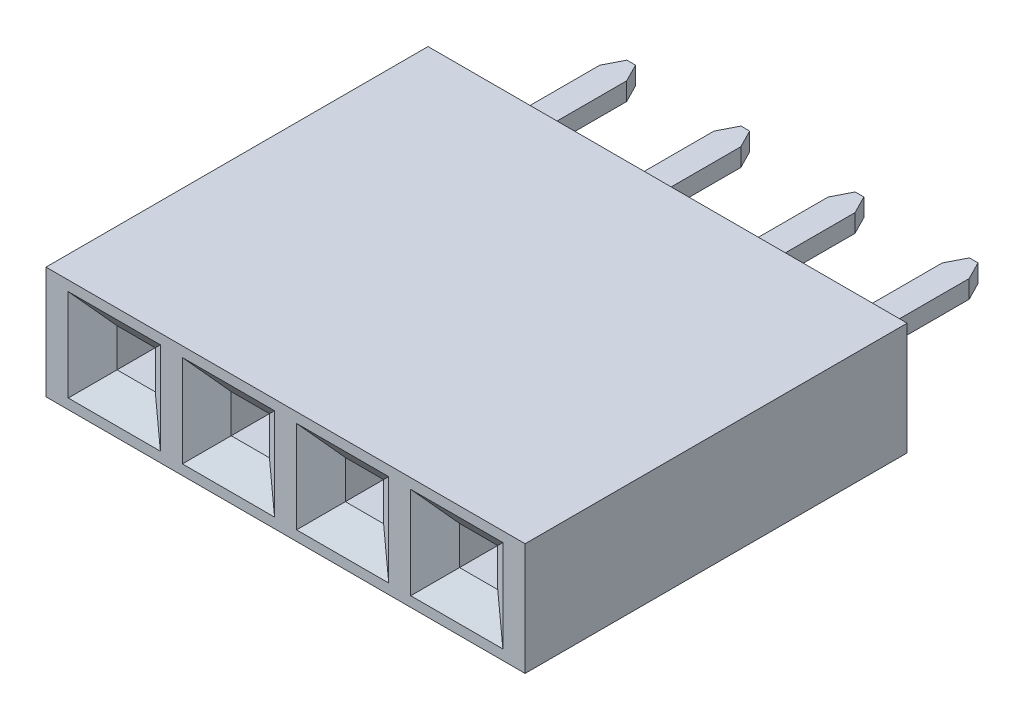
from build123d import *
from OCP.BRepFilletAPI import BRepFilletAPI_MakeChamfer

# Parameters (mm, degrees)
SKETCH_1_W                          = 10.66
SKETCH_1_H                          = 2.5
EXTRUDE_1_DEPTH                     = 8.5
SKETCH_2_W                          = 0.85
SKETCH_2_H                          = 0.85
CUT_EXTRUDE_1_DEPTH                 = 6
CHAMFER_1_SIZE                      = 0.6
CHAMFER_1_SIZE2                     = 0.48587042
PATTERN_LINEAR_1_COUNT              = 4
PATTERN_LINEAR_1_PITCH              = 2.54
CHAMFER_1_OF_PATTERN_LINEAR_1_SIZE2 = 0.48587042
CHAMFER_1_OF_PATTERN_LINEAR_1_SIZE  = 0.6
SKETCH_3_W                          = 0.6
SKETCH_3_H                          = 0.4
EXTRUDE_2_DEPTH                     = 3
CHAMFER_2_SIZE                      = 0.4
CHAMFER_2_SIZE2                     = 0.20381018
PATTERN_LINEAR_2_COUNT              = 4
PATTERN_LINEAR_2_PITCH              = 2.54


with BuildPart() as part:
    # Эскиз1 → Бобышка-Вытянуть1 (new body)
    with BuildSketch(Plane.XY):
        Rectangle(SKETCH_1_W, SKETCH_1_H)
    extrude(amount=EXTRUDE_1_DEPTH)

    # Эскиз2 → Вырез-Вытянуть1 (cut)
    with BuildSketch(Plane.XY.offset(8.5)):
        with Locations((3.81, 0)):
            Rectangle(SKETCH_2_W, SKETCH_2_H)
    cut_extrude_1 = extrude(amount=-CUT_EXTRUDE_1_DEPTH, mode=Mode.SUBTRACT)

    # Фаска1
    chamfer_1_edges = [part.edges().sort_by_distance(p)[0] for p in [
        (4.235, 0, 8.5),
        (3.81, 0.425, 8.5),
        (3.385, 0, 8.5),
        (3.81, -0.425, 8.5),
    ]]
    chamfer_1_side = [part.faces().sort_by_distance(p)[0] for p in [
        (-0.10617009, 0, 8.5),
    ]]
    chamfer(chamfer_1_edges, length=CHAMFER_1_SIZE, length2=CHAMFER_1_SIZE2, reference=chamfer_1_side[0])

    # Линейный массив1: Вырез-Вытянуть1 ×4
    with Locations(*[(-i * PATTERN_LINEAR_1_PITCH, 0, 0) for i in range(1, PATTERN_LINEAR_1_COUNT)]):
        add(cut_extrude_1, mode=Mode.SUBTRACT)

    # Фаска1 of Линейный массив1
    chamfer_1_of_pattern_linear_1_edges = [part.edges().sort_by_distance(p)[0] for p in [
        (1.695, 0, 8.5),
        (1.27, 0.425, 8.5),
        (0.845, 0, 8.5),
        (1.27, -0.425, 8.5),
        (-0.845, 0, 8.5),
        (-1.27, 0.425, 8.5),
        (-1.695, 0, 8.5),
        (-1.27, -0.425, 8.5),
        (-3.385, 0, 8.5),
        (-3.81, 0.425, 8.5),
        (-4.235, 0, 8.5),
        (-3.81, -0.425, 8.5),
    ]]
    chamfer(chamfer_1_of_pattern_linear_1_edges, length=CHAMFER_1_OF_PATTERN_LINEAR_1_SIZE, length2=CHAMFER_1_OF_PATTERN_LINEAR_1_SIZE2)


with BuildPart() as body_2:
    # Эскиз3 → Бобышка-Вытянуть2 (new body)
    with BuildSketch(Plane(origin=(0, 0, 0), x_dir=(-1, 0, 0), z_dir=(0, 0, -1))):
        with Locations((-3.81, 0)):
            Rectangle(SKETCH_3_W, SKETCH_3_H)
    extrude(amount=EXTRUDE_2_DEPTH)

    # Фаска2: one chamfer whose edges measure the first distance from different faces: ONE call of the kernel's chamfer builder (chamfer() names one face for all edges)
    chamfer_2_edges_1 = [body_2.edges().sort_by_distance(p)[0] for p in [
        (3.51, 0, -3),
    ]]
    chamfer_2_side_1 = [body_2.faces().sort_by_distance(p)[0] for p in [
        (3.51, 0, -1.5),
    ]]
    chamfer_2_edges_2 = [body_2.edges().sort_by_distance(p)[0] for p in [
        (4.11, 0, -3),
    ]]
    chamfer_2_side_2 = [body_2.faces().sort_by_distance(p)[0] for p in [
        (4.11, 0, -1.5),
    ]]
    chamfer_2 = BRepFilletAPI_MakeChamfer(body_2.part.solid().wrapped)
    for e in chamfer_2_edges_1:
        chamfer_2.Add(CHAMFER_2_SIZE, CHAMFER_2_SIZE2, e.wrapped, chamfer_2_side_1[0].wrapped)  # the first distance lies on this face
    for e in chamfer_2_edges_2:
        chamfer_2.Add(CHAMFER_2_SIZE, CHAMFER_2_SIZE2, e.wrapped, chamfer_2_side_2[0].wrapped)  # the first distance lies on this face
    add(Compound.cast(chamfer_2.Shape()), mode=Mode.REPLACE)


with BuildPart() as pattern_linear_2_1:
    # Линейный массив2: pattern copy
    add(body_2.part.moved(Location(Vector(-1, 0, 0) * (1 * PATTERN_LINEAR_2_PITCH))))


with BuildPart() as pattern_linear_2_2:
    # Линейный массив2: pattern copy
    add(body_2.part.moved(Location(Vector(-1, 0, 0) * (2 * PATTERN_LINEAR_2_PITCH))))


with BuildPart() as pattern_linear_2_3:
    # Линейный массив2: pattern copy
    add(body_2.part.moved(Location(Vector(-1, 0, 0) * (3 * PATTERN_LINEAR_2_PITCH))))


solid = Compound([part.part, body_2.part, pattern_linear_2_1.part, pattern_linear_2_2.part, pattern_linear_2_3.part])
